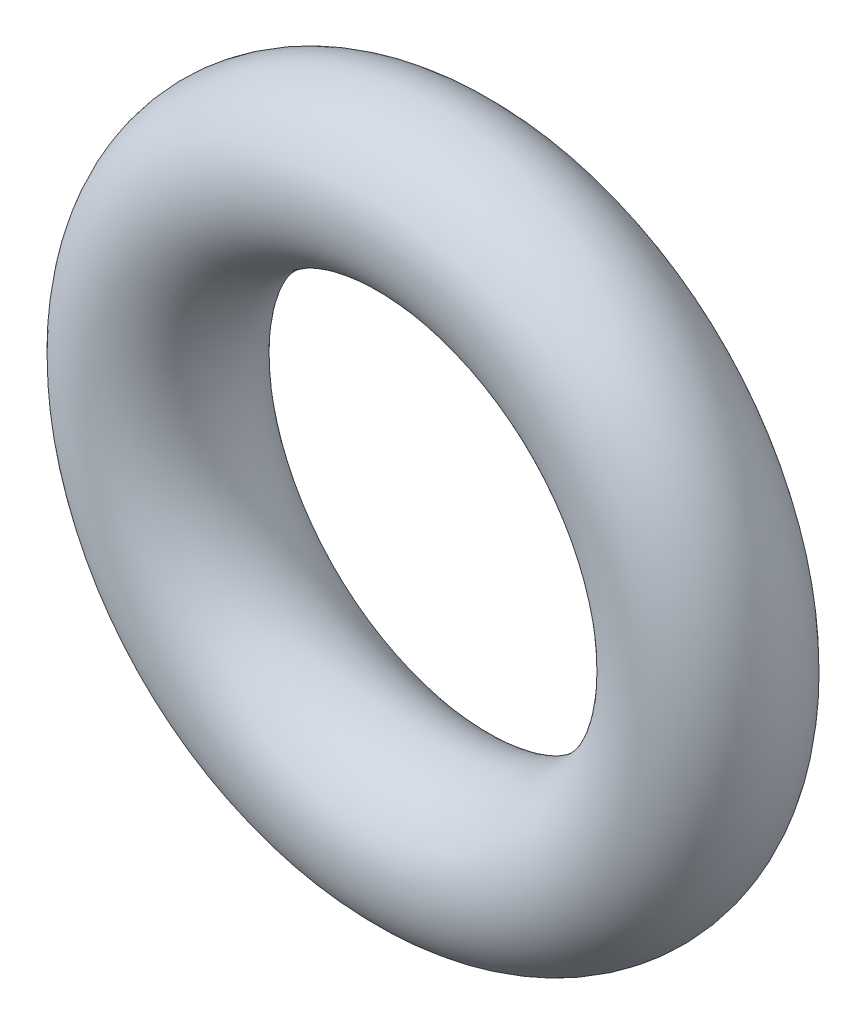
from build123d import *

# Parameters (mm, degrees)
SKETCH2_R = 0.5


with BuildPart() as part:
    # Sketch2 → Revolve1 (revolve)
    with BuildSketch(Plane(origin=(0, 0, 0), x_dir=(1, 0, 0), z_dir=(0, 1, 0)), mode=Mode.PRIVATE) as revolve1_sk:
        with Locations((1.75, 0)):
            Circle(SKETCH2_R)
    revolve(revolve1_sk.sketch.rotate(Axis((0, 0, -0.5), (0, 0, 1)), 180), axis=Axis((0, 0, -0.5), (0, 0, 1)))


solid = part.part
